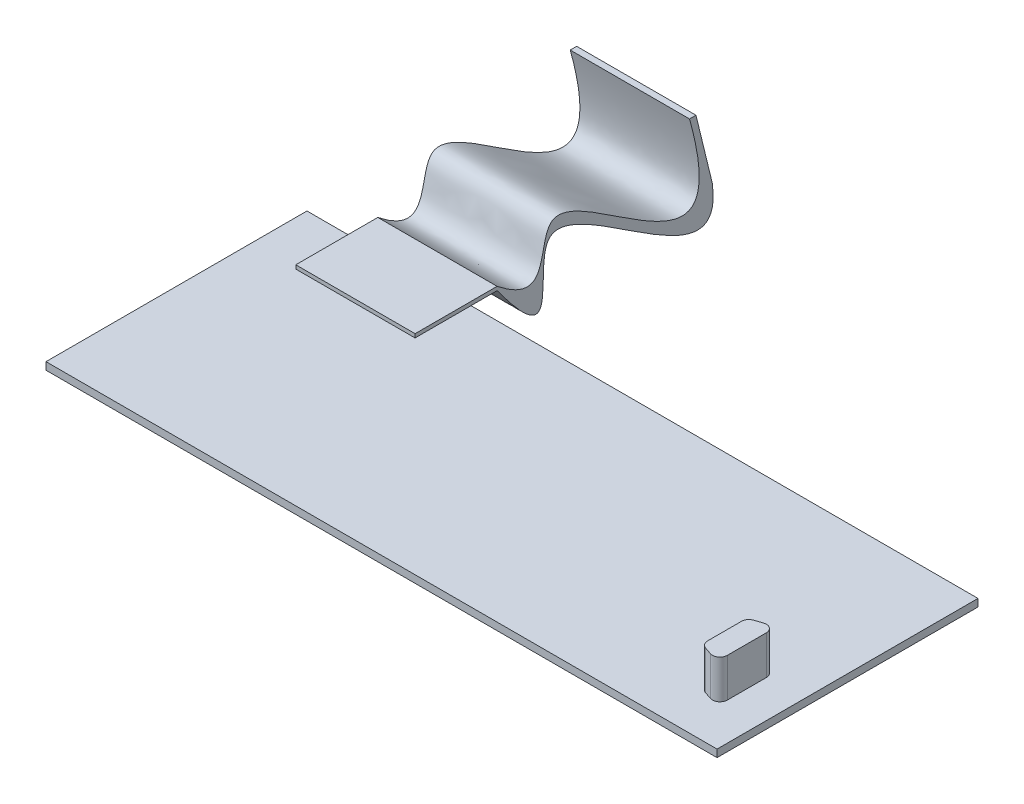
from build123d import *

# Parameters (mm, degrees)
SKETCH4_W           = 228.6
SKETCH4_H           = 88.9
BOSS_EXTRUDE3_DEPTH = 2.54
SKETCH5_W           = 33.02
SKETCH5_H           = 5.08
BOSS_EXTRUDE4_DEPTH = 2.54
SKETCH6_W           = 40.64
SKETCH6_H           = 27.94
BOSS_EXTRUDE5_DEPTH = 1.27
BOSS_EXTRUDE6_DEPTH = 40.64
BOSS_EXTRUDE7_DEPTH = 13.208
FILLET1_R           = 2.54


with BuildPart() as part:
    # Sketch4 → Boss-Extrude3 (new body)
    with BuildSketch(Plane(origin=(0, 0, 0), x_dir=(1, 0, 0), z_dir=(0, 1, 0))):
        with Locations((133.35, 63.5)):
            Rectangle(SKETCH4_W, SKETCH4_H)
    extrude(amount=BOSS_EXTRUDE3_DEPTH)

    # Sketch5 → Boss-Extrude4 (add)
    with BuildSketch(Plane(origin=(0, 2.54, 0), x_dir=(1, 0, 0), z_dir=(0, 1, 0))):
        with Locations((57.15, 95.25)):
            Rectangle(SKETCH5_W, SKETCH5_H)
    extrude(amount=BOSS_EXTRUDE4_DEPTH)

    # Sketch6 → Boss-Extrude5 (add)
    with BuildSketch(Plane(origin=(0, 5.08, 0), x_dir=(1, 0, 0), z_dir=(0, 1, 0))):
        with Locations((57.15, 100.33)):
            Rectangle(SKETCH6_W, SKETCH6_H)
    extrude(amount=BOSS_EXTRUDE5_DEPTH)

    # Sketch7 → Boss-Extrude6 (add)
    with BuildSketch(Plane.ZY.offset(-36.83)):
        with BuildLine():
            Line((-187.645232074, 0), (-182.055573159, 22.955935482))
            Line((-182.055573159, 22.955935482), (-179.858508249, 22.955935482))
            add(Edge.make_bspline(
                [(-114.3, 6.35), (-133.298148084, -8.81906553), (-116.510356825, 54.687069595), (-196.650549715, -37.947190727), (-179.858508249, 22.955935482)],
                knots=[0, 0, 0, 0, 0.345555248, 1, 1, 1, 1], degree=3))
            Line((-114.3, 6.35), (-114.3, 5.08))
            add(Edge.make_bspline(
                [(-114.3, 5.08), (-136.985708512, -26.134958418), (-109.503597428, 56.206538218), (-192.042694118, -34.207408775), (-187.645232074, 0)],
                knots=[0, 0, 0, 0, 0.382372791, 1, 1, 1, 1], degree=3))
        make_face()
    extrude(amount=-BOSS_EXTRUDE6_DEPTH)

    # Sketch8 → Boss-Extrude7 (add)
    with BuildSketch(Plane(origin=(0, 2.54, 0), x_dir=(1, 0, 0), z_dir=(0, 1, 0))):
        Polygon((227.33, 49.53), (234.95, 52.07), (234.95, 31.75), (227.33, 34.29), align=None)
    extrude(amount=BOSS_EXTRUDE7_DEPTH)

    # Fillet1
    fillet1_edges = [part.edges().sort_by_distance(p)[0] for p in [
        (227.33, 9.144, -49.53),
        (227.33, 9.144, -34.29),
        (234.95, 9.144, -31.75),
        (234.95, 9.144, -52.07),
    ]]
    fillet(fillet1_edges, radius=FILLET1_R)


solid = part.part
